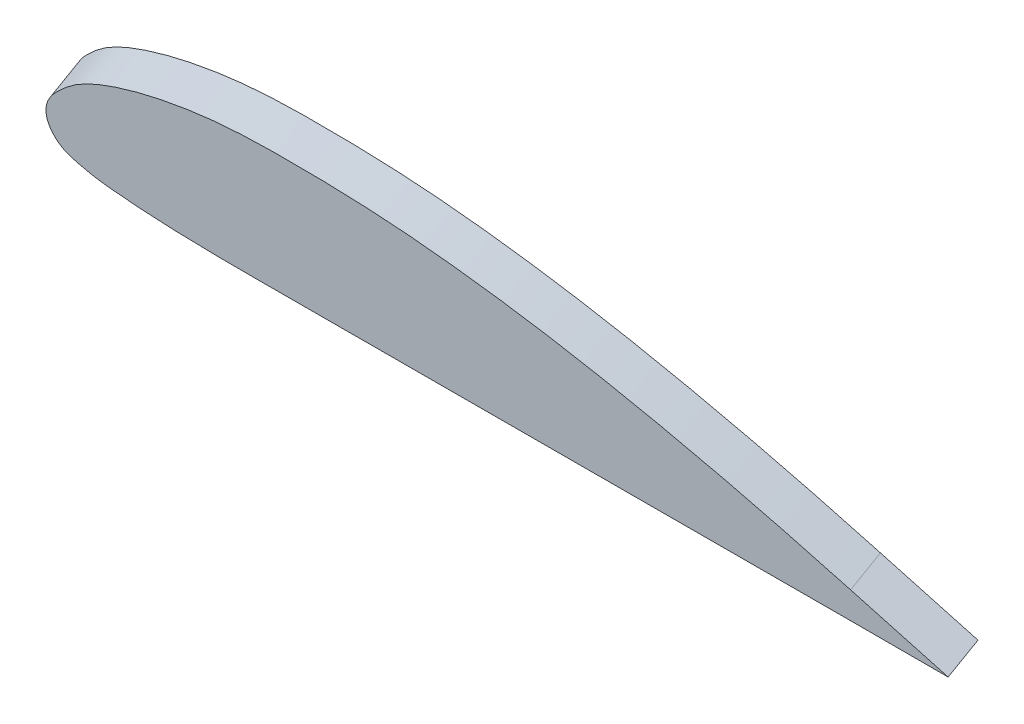
from build123d import *


with BuildPart() as part:
    # Sweep1: sweep along a path in Sketch2
    with BuildLine(Plane(origin=(0, 30, -600), x_dir=(0, 0, -1), z_dir=(0, 1, 0))) as sweep1_path:
        Line((-600, -397.078574821), (-605, -398.898425993))
    # Sketch1 → Sweep1 (sweep)
    with BuildSketch(Plane.XY):
        with BuildLine():
            Line((439.571065794, 23.11245238), (450.335963917, 23.11245238))
            Line((450.335963917, 23.11245238), (439.943594027, 25.963149641))
            add(Edge.make_bspline(
                [(439.943594027, 25.963149641), (436.482792761, 26.912470806), (429.550066215, 28.761348974), (419.041111507, 31.175855493), (408.45368919, 33.239439521), (399.529738818, 34.510609751), (392.351182969, 35.213505717), (386.932530949, 35.537288913), (381.527529236, 35.645443024), (377.015250499, 35.630267047), (373.36658729, 35.439001165), (370.62309669, 35.162533711), (367.905431389, 34.750314366), (365.202372021, 34.21045085), (362.962683699, 33.616092523), (361.199294652, 33.05342231), (359.868429843, 32.565910104), (358.760294975, 32.073508896), (357.883845635, 31.607210347), (357.2271418, 31.202964443), (356.595624686, 30.747463902), (356.005969851, 30.242954585), (355.500652437, 29.775352596), (355.010956825, 29.281519764), (354.609080991, 28.726654824), (354.374139314, 28.269321839), (354.235157948, 27.767100374), (354.200717629, 27.323885207), (354.244072954, 26.912672875), (354.367021799, 26.502136075), (354.509437786, 26.203995948), (354.729497016, 25.842655678), (355.029872167, 25.485093684), (355.403771523, 25.143741642), (355.822308781, 24.843121363), (356.277249077, 24.602580107), (356.850755271, 24.374581148), (357.507783855, 24.201019982), (358.14442207, 24.053143686), (358.851382423, 23.896037139), (359.561595356, 23.768264488), (360.506762957, 23.631729115), (361.661444971, 23.514624116), (363.003159238, 23.400138049), (364.817543156, 23.263530837), (367.076207924, 23.14390868), (369.783974516, 23.055592804), (372.484696578, 23.0107893), (375.179374968, 22.99445799), (377.869110838, 22.996363558), (381.44694881, 23.009432587), (385.914265581, 23.01766297), (391.281573942, 23.024424645), (396.646882489, 23.035034191), (402.012427726, 23.04476238), (409.166405957, 23.058020575), (418.108767199, 23.073638526), (428.839783056, 23.093255111), (435.993988436, 23.105642869), (439.571065794, 23.11245238)],
                knots=[0, 0, 0, 0, 0.062499515, 0.12499903, 0.187498545, 0.24999806, 0.281247817, 0.312497575, 0.343747332, 0.37499709, 0.390621968, 0.406246847, 0.421871726, 0.437496605, 0.453121483, 0.460933923, 0.468746362, 0.476558802, 0.480465021, 0.484371241, 0.488277461, 0.49218368, 0.4960899, 0.49999612, 0.501949229, 0.503902339, 0.504878894, 0.505855449, 0.506832004, 0.507808559, 0.508785114, 0.509761669, 0.511714779, 0.513667889, 0.515620998, 0.517574108, 0.519527218, 0.523433438, 0.527339657, 0.531245877, 0.535152097, 0.539058316, 0.546870756, 0.554683195, 0.562495635, 0.578120513, 0.593745392, 0.609370271, 0.62499515, 0.640620028, 0.656244907, 0.687494665, 0.718744422, 0.749994179, 0.781243937, 0.812493694, 0.874993209, 0.937492724, 0.999992239, 0.999992239, 0.999992239, 0.999992239], degree=3))
        make_face()
    sweep(path=sweep1_path.line)


solid = part.part
